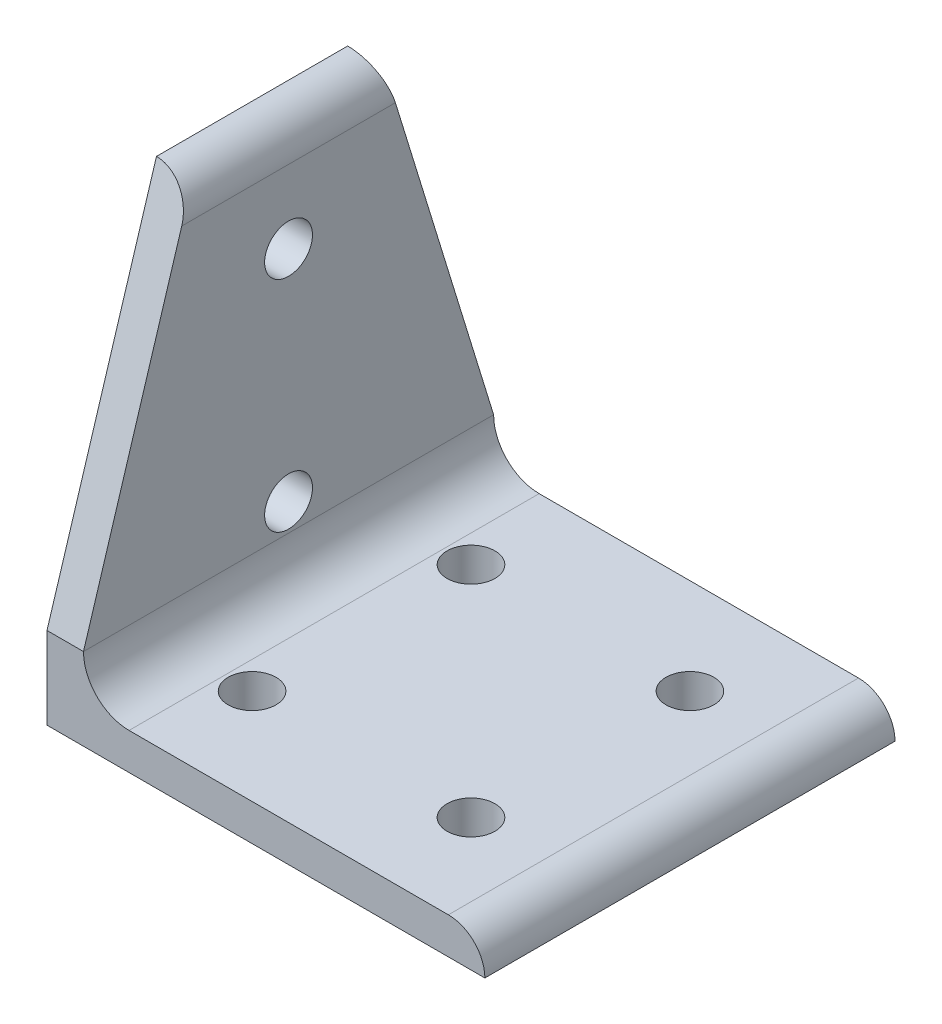
from build123d import *

# Parameters (mm, degrees)
BOSS_EXTRUDE1_DEPTH      = 35.687
BOSS_EXTRUDE1_DEPTH_BACK = 35.687
CUT_EXTRUDE1_DEPTH       = 88.202032482
CUT_EXTRUDE1_DEPTH_BACK  = 88.202032482
CUT_EXTRUDE2_DEPTH       = 88.202032482
CUT_EXTRUDE2_DEPTH_BACK  = 88.202032482
SKETCH6_R                = 4.1656
SKETCH7_R                = 4.1656
CUT_EXTRUDE3_DEPTH       = 88.202032482


with BuildPart() as part:
    # Sketch4 → Boss-Extrude1 (new, two sides: drawn at the far end of the back side and taken through both)
    with BuildSketch(Plane.XY.offset(-BOSS_EXTRUDE1_DEPTH_BACK)):
        with BuildLine():
            Line((-38.1, 38.1), (-38.1, -38.1))
            Line((-38.1, -38.1), (38.1, -38.1))
            ThreePointArc((38.1, -38.1), (36.240128061, -33.609871939), (31.75, -31.75))
            Line((31.75, -31.75), (-23.8252, -31.75))
            ThreePointArc((-23.8252, -31.75), (-29.42887982, -29.42887982), (-31.75, -23.8252))
            Line((-31.75, -23.8252), (-31.75, 31.75))
            ThreePointArc((-31.75, 31.75), (-33.609871939, 36.240128061), (-38.1, 38.1))
        make_face()
    extrude(amount=BOSS_EXTRUDE1_DEPTH + BOSS_EXTRUDE1_DEPTH_BACK)

    # Sketch5 → Cut-Extrude1 (cut, two sides: drawn at the far end of the back side and taken through both)
    with BuildSketch(Plane(origin=(-31.75, 0, 0), x_dir=(0, 0, -1), z_dir=(1, 0, 0)).offset(-CUT_EXTRUDE1_DEPTH_BACK)):
        Polygon((-35.687, -23.8252), (-16.637, 38.1), (-35.687, 38.1), align=None)
        Polygon((35.687, 38.1), (16.637, 38.1), (35.687, -23.8252), align=None)
    extrude(amount=CUT_EXTRUDE1_DEPTH + CUT_EXTRUDE1_DEPTH_BACK, mode=Mode.SUBTRACT)

    # Sketch6 → Cut-Extrude2 (cut, two sides: drawn at the far end of the back side and taken through both)
    with BuildSketch(Plane(origin=(-31.75, 0, 0), x_dir=(0, 0, -1), z_dir=(1, 0, 0)).offset(-CUT_EXTRUDE2_DEPTH_BACK)):
        with Locations(Location((0, 19.05, 0), (0, 0, 90))):
            Circle(SKETCH6_R)
        with Locations(Location((0, -19.05, 0), (0, 0, 90))):
            Circle(SKETCH6_R)
    extrude(amount=CUT_EXTRUDE2_DEPTH + CUT_EXTRUDE2_DEPTH_BACK, mode=Mode.SUBTRACT)

    # Sketch7 → Cut-Extrude3 (cut, through all)
    with BuildSketch(Plane(origin=(0, -31.75, 0), x_dir=(1, 0, 0), z_dir=(0, 1, 0))):
        with Locations(Location((-19.05, 19.05, 0), (0, 0, 180))):
            Circle(SKETCH7_R)
        with Locations((19.05, 19.05)):
            Circle(SKETCH7_R)
        with Locations(Location((19.05, -19.05, 0), (0, 0, 180))):
            Circle(SKETCH7_R)
        with Locations((-19.05, -19.05)):
            Circle(SKETCH7_R)
    extrude(amount=-CUT_EXTRUDE3_DEPTH, mode=Mode.SUBTRACT)


solid = part.part
